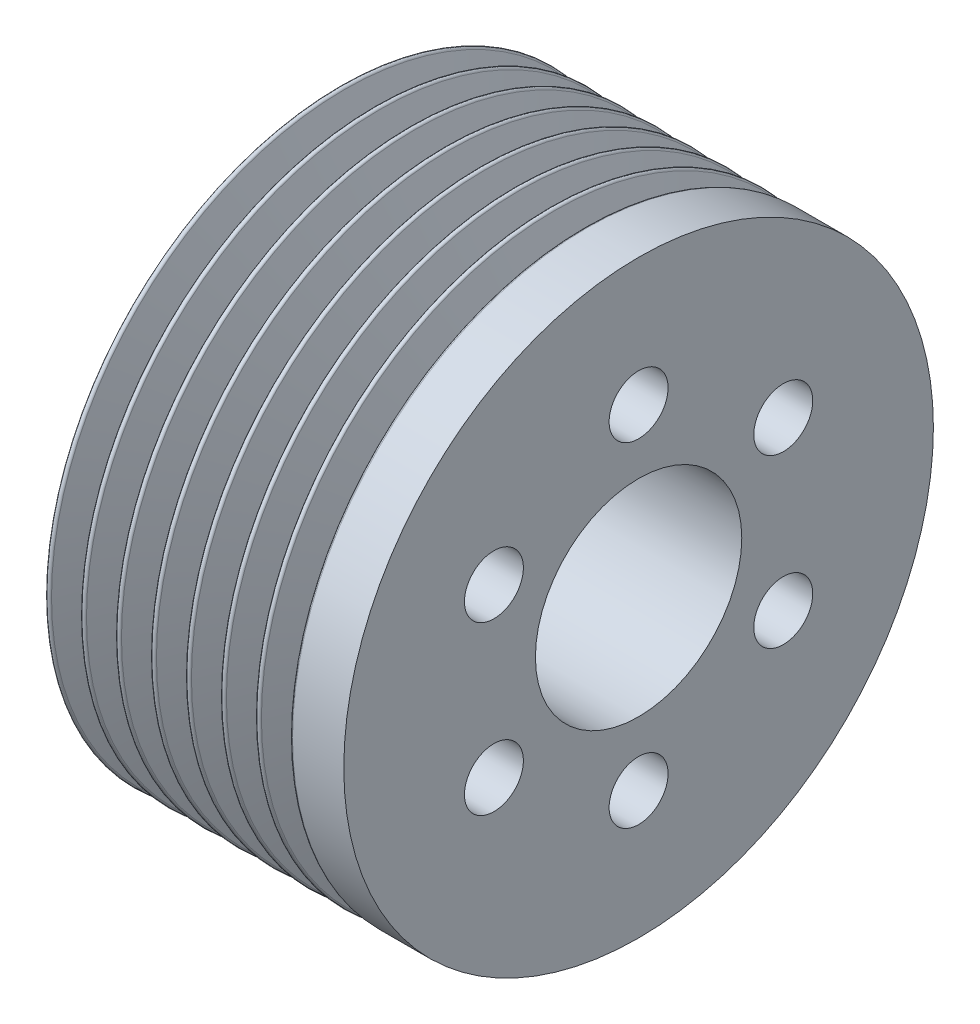
from build123d import *

# Parameters (mm, degrees)
LPATTERN1_COUNT    = 8
LPATTERN1_PITCH    = 3.56
SKETCH3_R          = 3
CUT_EXTRUDE1_DEPTH = 17.5


with BuildPart() as part:
    # Sketch1 → Revolve1 (revolve)
    with BuildSketch(Plane.XY, mode=Mode.PRIVATE) as revolve1_sk:
        Polygon((49, 10.5), (49, 30), (18, 30), (18, 21.5), (31.5, 21.5), (31.5, 10.5), align=None)
    revolve(revolve1_sk.sketch.rotate(Axis((0, 0, 0), (1, 0, 0)), 90), axis=Axis((0, 0, 0), (1, 0, 0)))

    # Sketch2 → Cut-Revolve1 (revolve, cut)
    with BuildSketch(Plane.XY, mode=Mode.PRIVATE) as cut_revolve1_sk:
        with BuildLine():
            Line((43.545831953, 29.837551845), (42.281001657, 26.45460955))
            ThreePointArc((42.281001657, 26.45460955), (42, 26.259671764), (41.718998343, 26.45460955))
            Line((41.718998343, 26.45460955), (40.454168047, 29.837551845))
            ThreePointArc((40.454168047, 29.837551845), (40.362499191, 29.955411734), (40.22, 30))
            Line((40.22, 30), (43.78, 30))
            ThreePointArc((43.78, 30), (43.637500809, 29.955411734), (43.545831953, 29.837551845))
        make_face()
    cut_revolve1 = revolve(cut_revolve1_sk.sketch.rotate(Axis((0, 0, 0), (1, 0, 0)), 90), axis=Axis((0, 0, 0), (1, 0, 0)), mode=Mode.SUBTRACT)

    # LPattern1: Cut-Revolve1 ×8
    with Locations(*[(-i * LPATTERN1_PITCH, 0, 0) for i in range(1, LPATTERN1_COUNT)]):
        add(cut_revolve1, mode=Mode.SUBTRACT)

    # Sketch3 → Cut-Extrude1 (cut)
    with BuildSketch(Plane(origin=(49, 0, 0), x_dir=(0, 0, -1), z_dir=(1, 0, 0))):
        with Locations((0, 17)):
            Circle(SKETCH3_R)
        with Locations((14.722431864, 8.5)):
            Circle(SKETCH3_R)
        with Locations((14.722431864, -8.5)):
            Circle(SKETCH3_R)
        with Locations((0, -17)):
            Circle(SKETCH3_R)
        with Locations((-14.722431864, -8.5)):
            Circle(SKETCH3_R)
        with Locations((-14.722431864, 8.5)):
            Circle(SKETCH3_R)
    extrude(amount=-CUT_EXTRUDE1_DEPTH, mode=Mode.SUBTRACT)


solid = part.part
